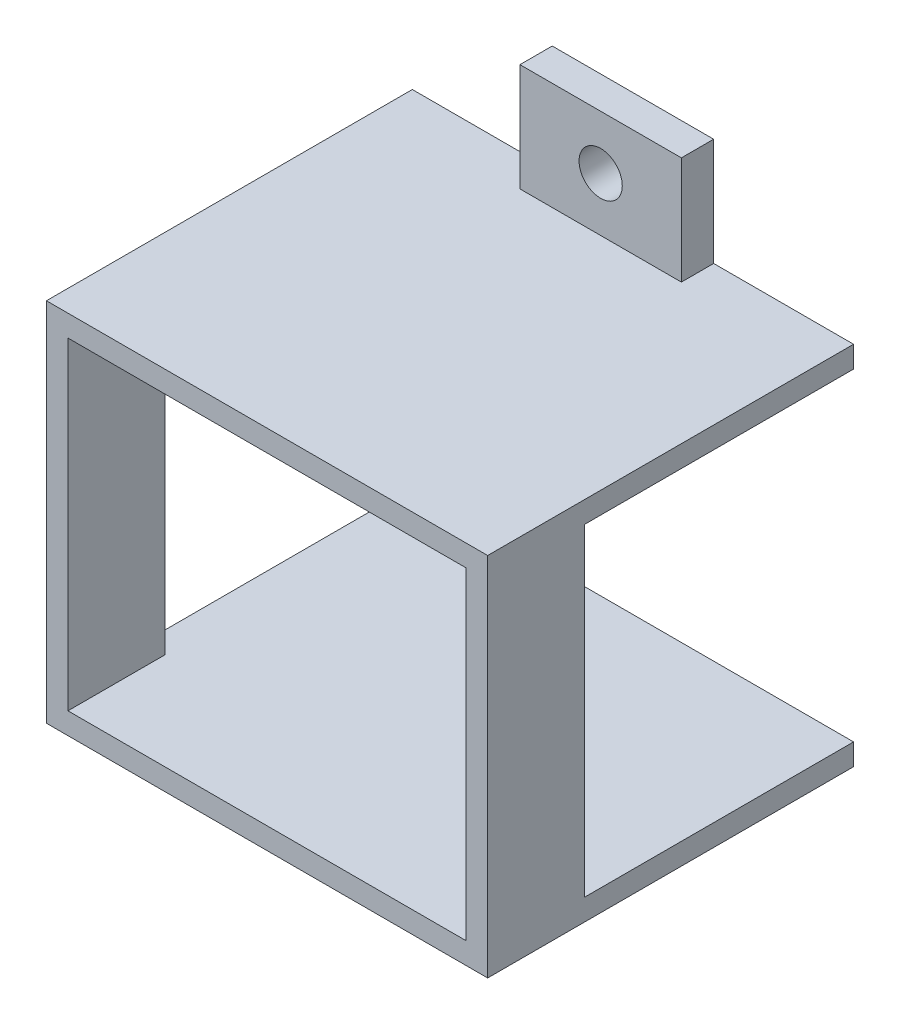
from build123d import *

# Parameters (mm, degrees)
SKETCH_1_W          = 41
SKETCH_1_H          = 34
SKETCH_1_W_2        = 37
SKETCH_1_H_2        = 30
EXTRUDE_1_DEPTH     = 34
SKETCH_2_W          = 15
SKETCH_2_H          = 3
EXTRUDE_2_DEPTH     = 10
SKETCH_3_R          = 2.008063055
CUT_EXTRUDE_1_DEPTH = 10
SKETCH_4_W          = 25
SKETCH_4_H          = 30
CUT_EXTRUDE_2_DEPTH = 60


with BuildPart() as part:
    # 草圖1 → 填料-伸長1 (new body)
    with BuildSketch(Plane.XY):
        Rectangle(SKETCH_1_W, SKETCH_1_H)
        Rectangle(SKETCH_1_W_2, SKETCH_1_H_2, mode=Mode.SUBTRACT)
    extrude(amount=EXTRUDE_1_DEPTH)

    # 草圖2 → 填料-伸長2 (add)
    with BuildSketch(Plane(origin=(0, 17, 0), x_dir=(1, 0, 0), z_dir=(0, 1, 0))):
        with Locations((0, -1.5)):
            Rectangle(SKETCH_2_W, SKETCH_2_H)
    extrude_2 = extrude(amount=EXTRUDE_2_DEPTH)

    # 草圖3 → 除料-伸長1 (cut)
    with BuildSketch(Plane.XY.offset(3)):
        with Locations((0, 22)):
            Circle(SKETCH_3_R)
    cut_extrude_1 = extrude(amount=-CUT_EXTRUDE_1_DEPTH, mode=Mode.SUBTRACT)

    # 鏡射1: 填料-伸長2, 除料-伸長1 across plane
    add(extrude_2.mirror(Plane.ZX))
    add(cut_extrude_1.mirror(Plane.ZX), mode=Mode.SUBTRACT)

    # 草圖4 → 除料-伸長2 (cut)
    with BuildSketch(Plane.ZY.offset(20.5)):
        with Locations((12.5, 0)):
            Rectangle(SKETCH_4_W, SKETCH_4_H)
    extrude(amount=-CUT_EXTRUDE_2_DEPTH, mode=Mode.SUBTRACT)


solid = part.part
